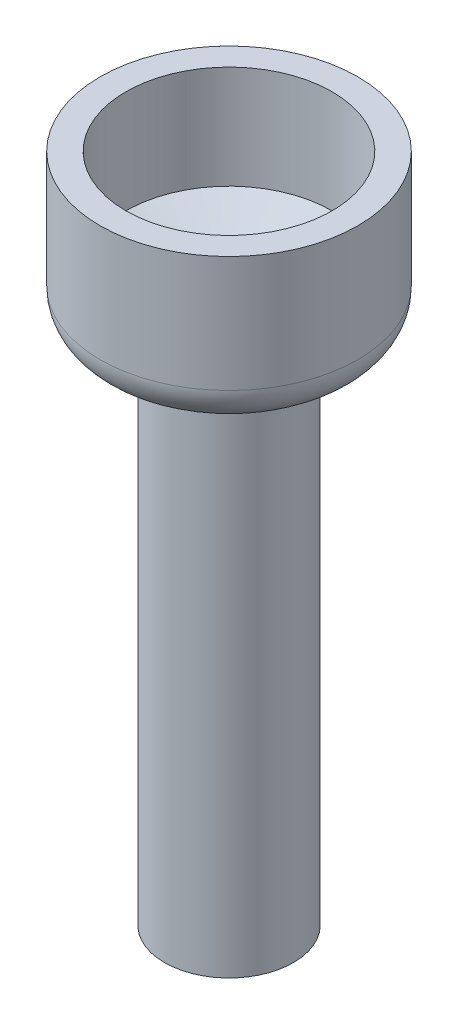
from build123d import *


with BuildPart() as part:
    # Sketch1 → Revolve1 (revolve)
    with BuildSketch(Plane.XY, mode=Mode.PRIVATE) as revolve1_sk:
        with BuildLine():
            Line((-3.5, 0), (-2.5, 0))
            Line((-2.5, 0), (-2.5, -20))
            Line((-2.5, -20), (-0.75, -20))
            Line((-0.75, -20), (-0.75, 1))
            Line((-0.75, 1), (-4, 2))
            Line((-4, 2), (-4, 6))
            Line((-4, 6), (-5, 6))
            Line((-5, 6), (-5, 1.5))
            ThreePointArc((-5, 1.5), (-4.560660172, 0.439339828), (-3.5, 0))
        make_face()
    revolve(revolve1_sk.sketch.rotate(Axis((0, 0, 0), (0, -1, 0)), 270), axis=Axis((0, 0, 0), (0, -1, 0)))


solid = part.part
